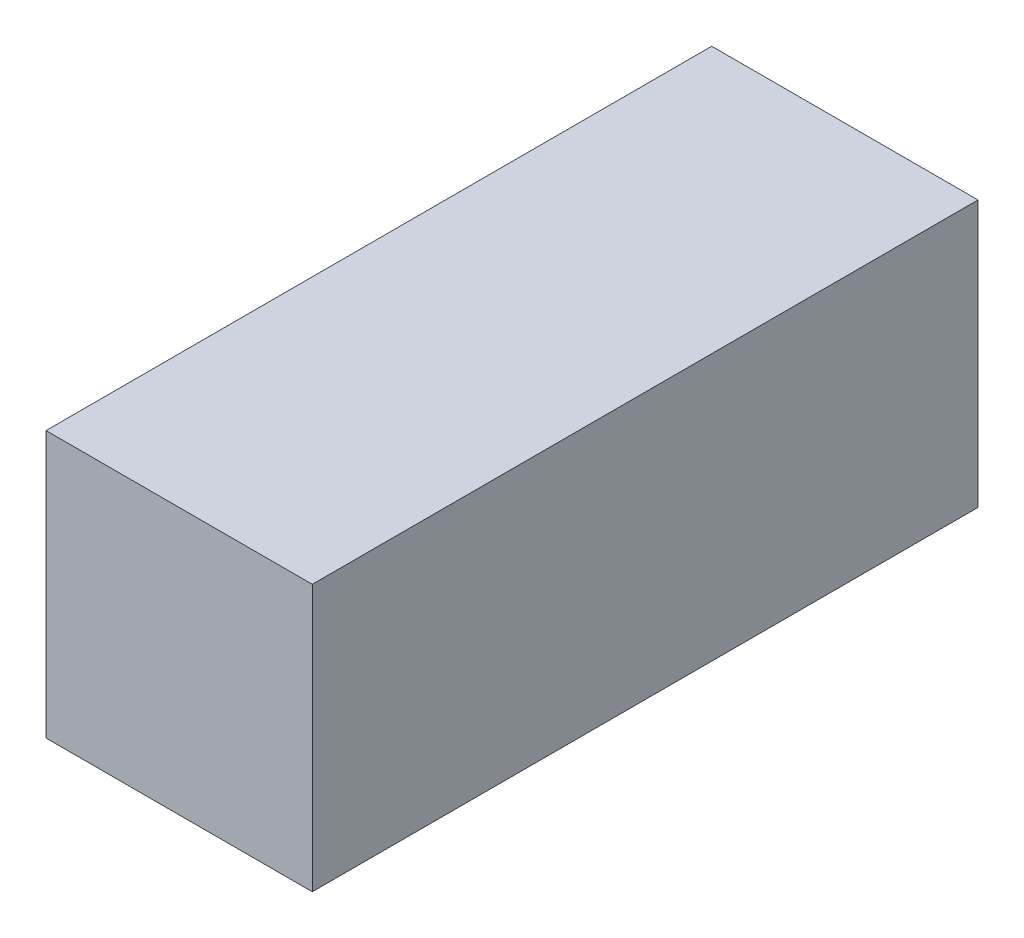
from build123d import *

# Parameters (mm, degrees)
SKETCH1_W           = 101.6
SKETCH1_H           = 101.6
BOSS_EXTRUDE1_DEPTH = 254


with BuildPart() as part:
    # Sketch1 → Boss-Extrude1 (new body)
    with BuildSketch(Plane.XY):
        Rectangle(SKETCH1_W, SKETCH1_H)
    extrude(amount=BOSS_EXTRUDE1_DEPTH)


solid = part.part
